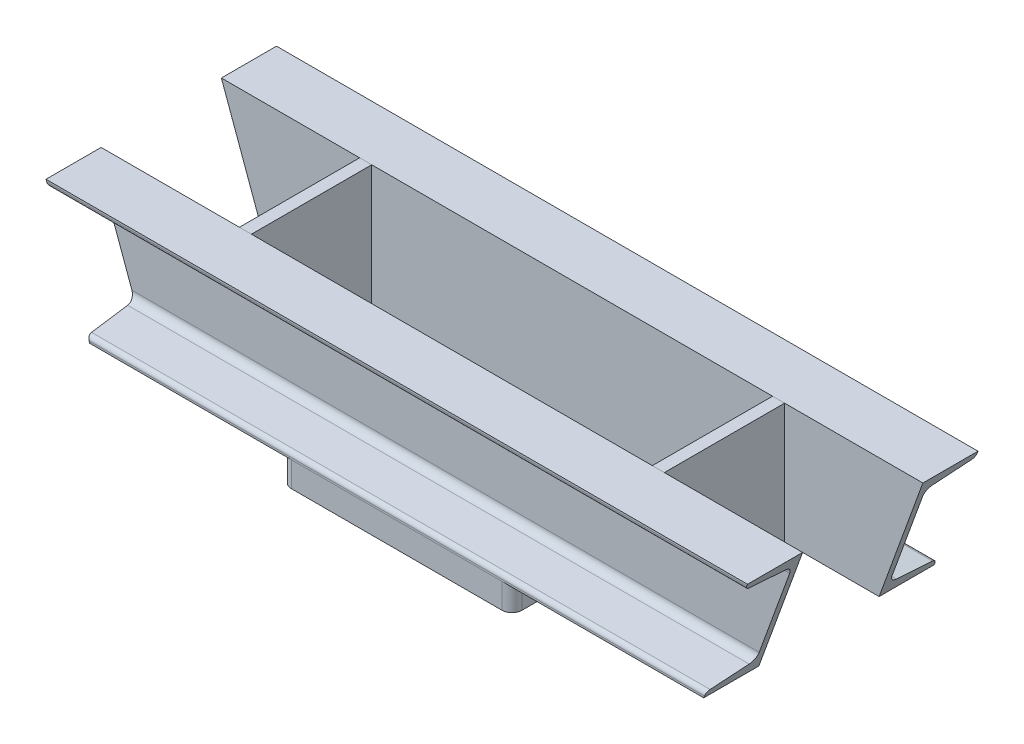
from build123d import *

# Parameters (mm, degrees)
C_CHANNEL_120_X_12_1_DEPTH = 700
C_CHANNEL_120_X_12_2_DEPTH = 700
BOSS_EXTRUDE1_REACH        = 411.298
SKETCH13_W                 = 12
SKETCH13_H                 = 120
BOSS_EXTRUDE3_DEPTH        = 25
SKETCH16_R                 = 40
CUT_EXTRUDE2_DEPTH         = 25
CUT_EXTRUDE3_DEPTH         = 396.916657897
CUT_EXTRUDE3_DEPTH_BACK    = 396.916657897


with BuildPart() as part:
    # Sketch1 → C channel 120 X 12(1) (new body)
    with BuildSketch(Plane(origin=(-350, 0, 60), x_dir=(0, 0, 1), z_dir=(1, 0, 0))):
        with BuildLine():
            Line((55, 120), (0, 120))
            Line((0, 120), (0, 0))
            Line((0, 0), (55, 0))
            Line((55, 0), (55, 1.896373189))
            ThreePointArc((55, 1.896373189), (53.844151715, 4.907460917), (50.970378085, 6.371721718))
            Line((50.970378085, 6.371721718), (13.463772294, 10.313824837))
            ThreePointArc((13.463772294, 10.313824837), (8.354841396, 12.916955149), (6.3, 18.27))
            Line((6.3, 18.27), (6.3, 101.74))
            ThreePointArc((6.3, 101.74), (8.354841396, 107.093044851), (13.463772294, 109.696175163))
            Line((13.463772294, 109.696175163), (50.970378085, 113.638278282))
            ThreePointArc((50.970378085, 113.638278282), (53.844151715, 115.102539083), (55, 118.113626811))
            Line((55, 118.113626811), (55, 120))
        make_face()
    extrude(amount=C_CHANNEL_120_X_12_1_DEPTH)


with BuildPart() as body_2:
    # Sketch11 → C channel 120 X 12(2) (new body)
    with BuildSketch(Plane(origin=(-350, 0, -60), x_dir=(0, 0, -1), z_dir=(-1, 0, 0))):
        with BuildLine():
            Line((55, 120), (0, 120))
            Line((0, 120), (0, 0))
            Line((0, 0), (55, 0))
            Line((55, 0), (55, 1.896373189))
            ThreePointArc((55, 1.896373189), (53.844151715, 4.907460917), (50.970378085, 6.371721718))
            Line((50.970378085, 6.371721718), (13.463772294, 10.313824837))
            ThreePointArc((13.463772294, 10.313824837), (8.354841396, 12.916955149), (6.3, 18.27))
            Line((6.3, 18.27), (6.3, 101.74))
            ThreePointArc((6.3, 101.74), (8.354841396, 107.093044851), (13.463772294, 109.696175163))
            Line((13.463772294, 109.696175163), (50.970378085, 113.638278282))
            ThreePointArc((50.970378085, 113.638278282), (53.844151715, 115.102539083), (55, 118.113626811))
            Line((55, 118.113626811), (55, 120))
        make_face()
    extrude(amount=-C_CHANNEL_120_X_12_2_DEPTH)


with BuildPart() as body_3:

    # Sketch13 → Boss-Extrude1 (new, up to next)
    with BuildSketch(Plane.XY.offset(-60), mode=Mode.PRIVATE) as boss_extrude1_sk1:
        with Locations((-206, -60)):
            Rectangle(SKETCH13_W, SKETCH13_H)
    boss_extrude1_tool1 = extrude(boss_extrude1_sk1.sketch, amount=BOSS_EXTRUDE1_REACH, mode=Mode.PRIVATE) - part.part
    # Sketch13 → Boss-Extrude1 (new, up to next)
    with BuildSketch(Plane.XY.offset(-60), mode=Mode.PRIVATE) as boss_extrude1_sk2:
        with Locations((206, -60)):
            Rectangle(SKETCH13_W, SKETCH13_H)
    boss_extrude1_tool2 = extrude(boss_extrude1_sk2.sketch, amount=BOSS_EXTRUDE1_REACH, mode=Mode.PRIVATE) - part.part
    add(boss_extrude1_tool1.solids().sort_by_distance((-206, -60, -60))[0])
    add(boss_extrude1_tool2.solids().sort_by_distance((206, -60, -60))[0])


with BuildPart() as body_4:
    # Sketch15 → Boss-Extrude3 (new body)
    with BuildSketch(Plane.XZ.offset(120)):
        with BuildLine():
            Line((-105, -115), (105, -115))
            ThreePointArc((105, -115), (112.071067812, -112.071067812), (115, -105))
            Line((115, -105), (115, 105))
            ThreePointArc((115, 105), (112.071067812, 112.071067812), (105, 115))
            Line((105, 115), (-105, 115))
            ThreePointArc((-105, 115), (-112.071067812, 112.071067812), (-115, 105))
            Line((-115, 105), (-115, -105))
            ThreePointArc((-115, -105), (-112.071067812, -112.071067812), (-105, -115))
        make_face()
    extrude(amount=BOSS_EXTRUDE3_DEPTH)

    # Sketch16 → Cut-Extrude2 (cut)
    with BuildSketch(Plane.XZ.offset(145)):
        with Locations(Location((0, 0, 0), (0, 0, 270))):
            Circle(SKETCH16_R)
    extrude(amount=-CUT_EXTRUDE2_DEPTH, mode=Mode.SUBTRACT)


with BuildPart() as cut_extrude3_tool:
    # Sketch17 → Cut-Extrude3 (new, two sides: drawn at the far end of the back side and taken through both)
    with BuildSketch(Plane.XY.offset(-CUT_EXTRUDE3_DEPTH_BACK)):
        Polygon((-350, 0), (-350, -120), (-306.323571888, -120), align=None)
        Polygon((350, 0), (350, -120), (306.323571888, -120), align=None)
    extrude(amount=CUT_EXTRUDE3_DEPTH + CUT_EXTRUDE3_DEPTH_BACK)


with BuildPart() as part_1:
    add(part.part)

    # Cut-Extrude3: cut by cut_extrude3_tool
    add(cut_extrude3_tool.part, mode=Mode.SUBTRACT)


with BuildPart() as body_2_1:
    add(body_2.part)

    # Cut-Extrude3: cut by cut_extrude3_tool
    add(cut_extrude3_tool.part, mode=Mode.SUBTRACT)


solid = Compound([body_3.part, body_4.part, part_1.part, body_2_1.part])
